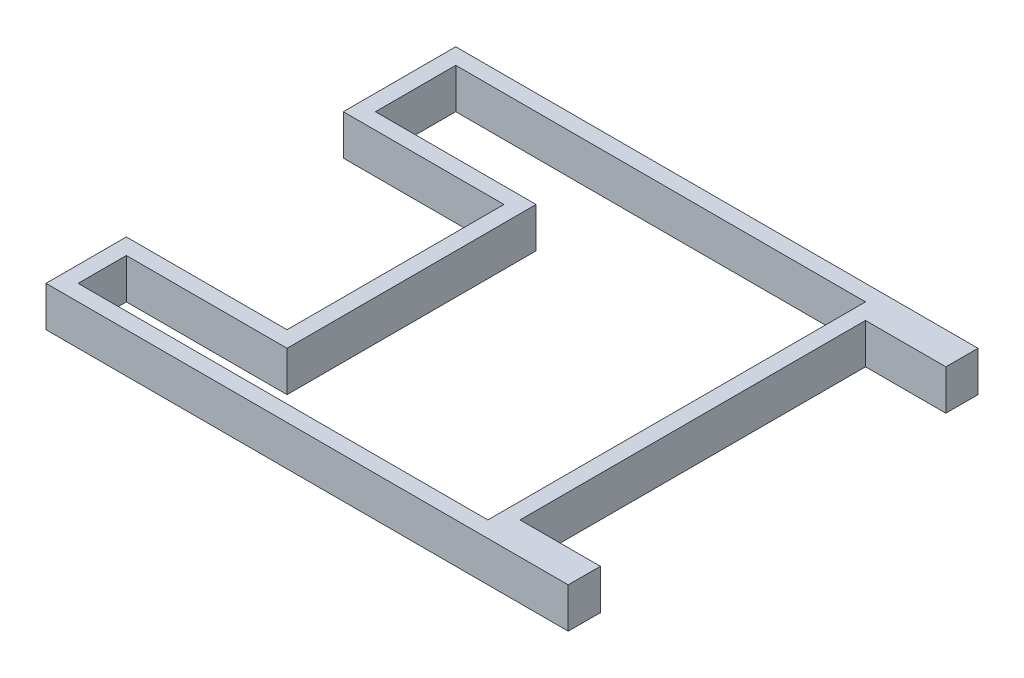
from build123d import *

# Parameters (mm, degrees)
EXTRUDE_4_DEPTH = 5


with BuildPart() as part:
    # 草图1 → 凸台-拉伸4 (new body)
    with BuildSketch(Plane(origin=(0, 0, 0), x_dir=(1, 0, 0), z_dir=(0, 1, 0))):
        Polygon((-44.775072214, 7.146396396), (-24.775072214, 7.146396396), (-24.775072214, -19.853603604), (-44.775072214, -19.853603604), (-44.775072214, -29.853603604), (20.224927786, -29.853603604), (20.224927786, -25.853603604), (10.224927786, -25.853603604), (10.224927786, 17.146396396), (20.224927786, 17.146396396), (20.224927786, 21.146396396), (-44.775072214, 21.146396396), align=None)
        Polygon((-42.775072214, 19.146396396), (8.224927786, 19.146396396), (8.224927786, -27.853603604), (-42.775072214, -27.853603604), (-42.775072214, -21.853603604), (-22.775072214, -21.853603604), (-22.775072214, 9.146396396), (-42.775072214, 9.146396396), align=None, mode=Mode.SUBTRACT)
    extrude(amount=EXTRUDE_4_DEPTH)


solid = part.part
